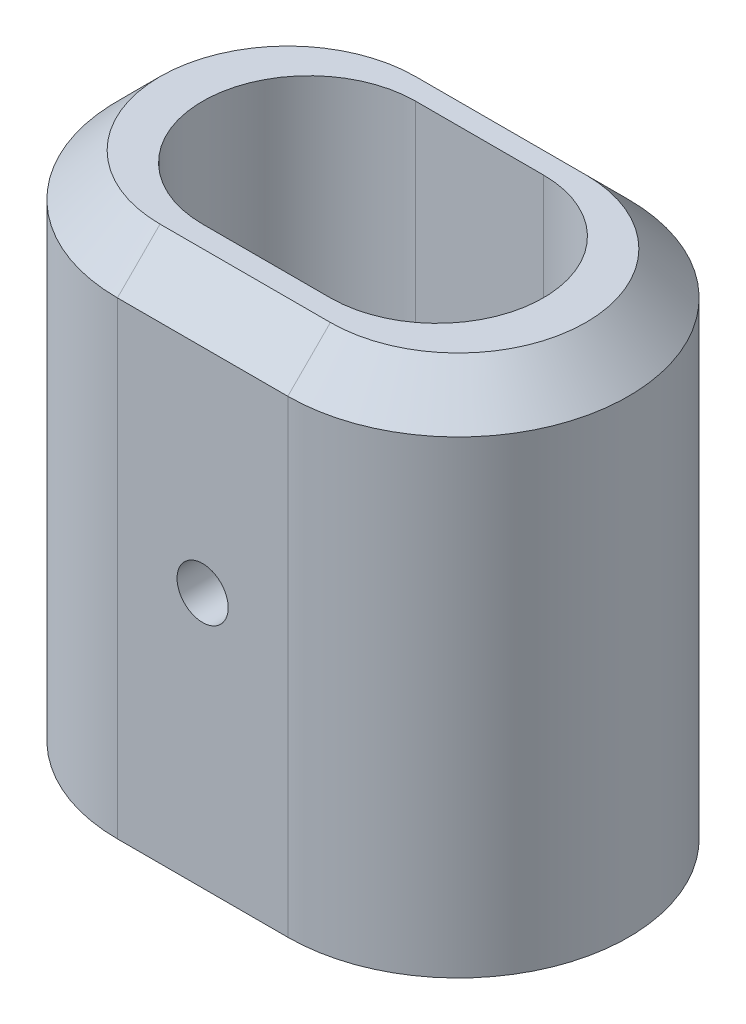
from build123d import *

# Parameters (mm, degrees)
SKETCH1_W           = 60
SKETCH1_H           = 60
BOSS_EXTRUDE1_DEPTH = 20
CUT_EXTRUDE1_DEPTH  = 60
CHAMFER1_SIZE       = 5
SKETCH6_R           = 3
CUT_EXTRUDE2_DEPTH  = 59.309518948
SKETCH9_R           = 12.5
CUT_EXTRUDE4_DEPTH  = 71


with BuildPart() as part:
    # Sketch1 → Boss-Extrude1 (new, symmetric)
    with BuildSketch(Plane.XY):
        Rectangle(SKETCH1_W, SKETCH1_H)
    extrude(amount=BOSS_EXTRUDE1_DEPTH, both=True)

    # Sketch5 → Cut-Extrude1 (cut)
    with BuildSketch(Plane.XZ.offset(30)):
        with BuildLine():
            ThreePointArc((30, 0), (24.142135624, -14.142135624), (10, -20))
            Line((10, -20), (30, -20))
            Line((30, -20), (30, 0))
        make_face()
        with BuildLine():
            Line((30, 20), (10.000000023, 20))
            ThreePointArc((10.000000023, 20), (24.142135632, 14.142135615), (30, 0))
            Line((30, 0), (30, 20))
        make_face()
        with BuildLine():
            ThreePointArc((-30, -1.4e-08), (-24.142135621, 14.142135627), (-9.999999977, 20))
            Line((-9.999999977, 20), (-30, 20))
            Line((-30, 20), (-30, -1.4e-08))
        make_face()
        with BuildLine():
            Line((-30, -20), (-10, -20))
            ThreePointArc((-10, -20), (-24.142135619, -14.142135629), (-30, -1.4e-08))
            Line((-30, -1.4e-08), (-30, -20))
        make_face()
    extrude(amount=-CUT_EXTRUDE1_DEPTH, mode=Mode.SUBTRACT)

    # Chamfer1
    chamfer1_edges = [part.edges().sort_by_distance(p)[0] for p in [
        (0, 30, -20),
        (30, 30, -1.2e-08),
        (-30, 30, 1.2e-08),
        (2.3e-08, 30, 20),
    ]]
    chamfer(chamfer1_edges, length=CHAMFER1_SIZE)

    # Sketch6 → Cut-Extrude2 (cut, through all)
    with BuildSketch(Plane(origin=(0, 0, -20), x_dir=(-1, 0, 0), z_dir=(0, 0, -1))):
        Circle(SKETCH6_R)
    extrude(amount=-CUT_EXTRUDE2_DEPTH, mode=Mode.SUBTRACT)

    # Sketch9 → Cut-Extrude4 (cut, through all)
    with BuildSketch(Plane.XZ.offset(30)):
        with Locations((-7.499382611, 0)):
            Circle(SKETCH9_R)
        with Locations((7.499382611, 0)):
            Circle(SKETCH9_R)
        with BuildLine():
            ThreePointArc((0, 10.000463012), (3.546901596, 11.858663239), (7.499382611, 12.5))
            Line((7.499382611, 12.5), (-7.499382623, 12.5))
            ThreePointArc((-7.499382623, 12.5), (-3.546901601, 11.858663241), (0, 10.000463012))
        make_face()
        with BuildLine():
            Line((-7.499382656, -12.5), (7.499382577, -12.5))
            ThreePointArc((7.499382577, -12.5), (3.54690158, -11.858663234), (0, -10.000463012))
            ThreePointArc((0, -10.000463012), (-3.546901617, -11.858663246), (-7.499382656, -12.5))
        make_face()
    extrude(amount=-CUT_EXTRUDE4_DEPTH, mode=Mode.SUBTRACT)


solid = part.part
